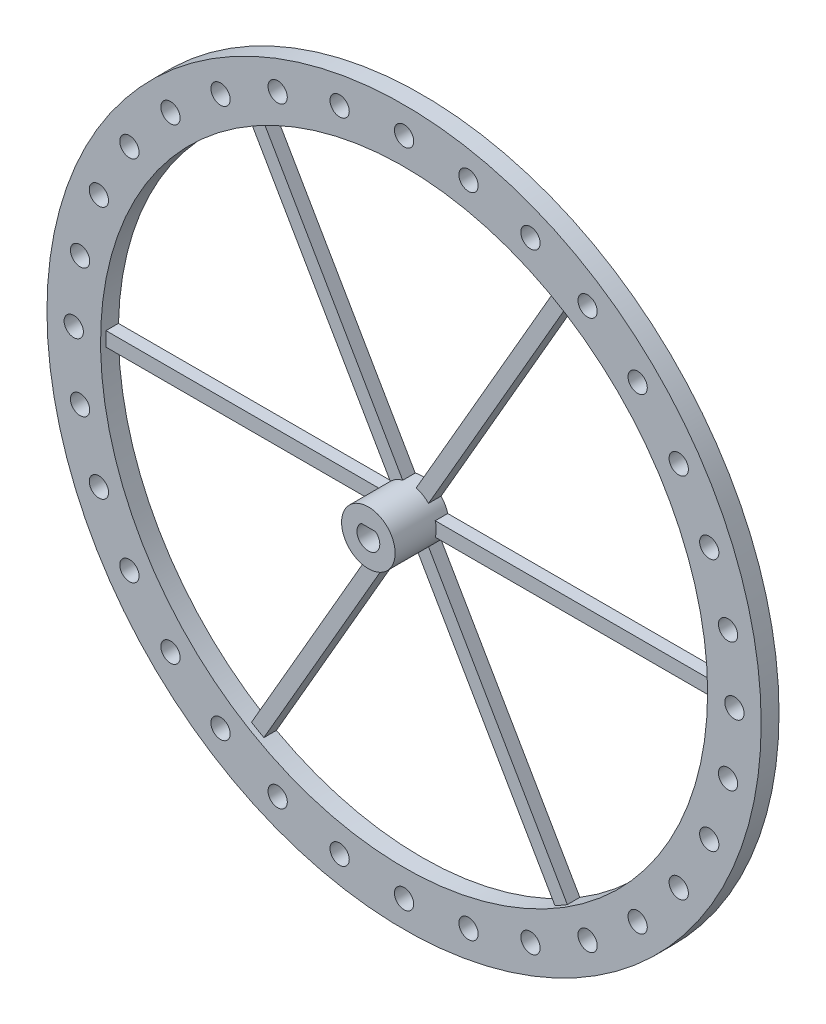
from build123d import *

# Parameters (mm, degrees)
SKETCH1_R           = 2.7
BOSS_EXTRUDE1_DEPTH = 5
SKETCH2_R           = 7.5
BOSS_EXTRUDE2_DEPTH = 15
BOSS_EXTRUDE3_DEPTH = 3.5


with BuildPart() as part:
    # Sketch1 → Boss-Extrude1 (new body)
    # profile 1 of 4: a face of its own
    with BuildSketch(Plane.XY):
        with BuildLine():
            Line((0, 89.8), (0, 85))
            ThreePointArc((0, 85), (60.104076401, 60.104076401), (85, 0))
            Line((85, 0), (89.8, 0))
            ThreePointArc((89.8, 0), (92.5, 2.7), (95.2, 0))
            Line((95.2, 0), (100, 0))
            ThreePointArc((100, 0), (70.710678119, 70.710678119), (0, 100))
            Line((0, 100), (0, 95.2))
            ThreePointArc((0, 95.2), (1.909188309, 94.409188309), (2.7, 92.5))
            ThreePointArc((2.7, 92.5), (1.909188309, 90.590811691), (0, 89.8))
        make_face()
        with Locations((90.722638437, 18.045854786)):
            Circle(SKETCH1_R, mode=Mode.SUBTRACT)
        with Locations((85.458856757, 35.398217494)):
            Circle(SKETCH1_R, mode=Mode.SUBTRACT)
        with Locations((18.045854786, 90.722638437)):
            Circle(SKETCH1_R, mode=Mode.SUBTRACT)
        with Locations((35.398217494, 85.458856757)):
            Circle(SKETCH1_R, mode=Mode.SUBTRACT)
        with Locations((65.40737726, 65.40737726)):
            Circle(SKETCH1_R, mode=Mode.SUBTRACT)
        with Locations((76.910939138, 51.390246554)):
            Circle(SKETCH1_R, mode=Mode.SUBTRACT)
        with Locations((51.390246554, 76.910939138)):
            Circle(SKETCH1_R, mode=Mode.SUBTRACT)
    # profile 2 of 4: a face of its own
    with BuildSketch(Plane.XY):
        with BuildLine():
            ThreePointArc((85, 0), (60.104076401, -60.104076401), (0, -85))
            Line((0, -85), (0, -89.8))
            ThreePointArc((0, -89.8), (1.909188309, -90.590811691), (2.7, -92.5))
            ThreePointArc((2.7, -92.5), (1.909188309, -94.409188309), (0, -95.2))
            Line((0, -95.2), (0, -100))
            ThreePointArc((0, -100), (70.710678119, -70.710678119), (100, 0))
            Line((100, 0), (95.2, 0))
            ThreePointArc((95.2, 0), (92.5, -2.7), (89.8, 0))
            Line((89.8, 0), (85, 0))
        make_face()
        with Locations((18.045854786, -90.722638437)):
            Circle(SKETCH1_R, mode=Mode.SUBTRACT)
        with Locations((35.398217494, -85.458856757)):
            Circle(SKETCH1_R, mode=Mode.SUBTRACT)
        with Locations((51.390246554, -76.910939138)):
            Circle(SKETCH1_R, mode=Mode.SUBTRACT)
        with Locations((65.40737726, -65.40737726)):
            Circle(SKETCH1_R, mode=Mode.SUBTRACT)
        with Locations((76.910939138, -51.390246554)):
            Circle(SKETCH1_R, mode=Mode.SUBTRACT)
        with Locations((85.458856757, -35.398217494)):
            Circle(SKETCH1_R, mode=Mode.SUBTRACT)
        with Locations((90.722638437, -18.045854786)):
            Circle(SKETCH1_R, mode=Mode.SUBTRACT)
    # profile 3 of 4: a face of its own
    with BuildSketch(Plane.XY):
        with BuildLine():
            ThreePointArc((0, -85), (-60.104076401, -60.104076401), (-85, 0))
            Line((-85, 0), (-89.8, 0))
            ThreePointArc((-89.8, 0), (-92.5, -2.7), (-95.2, 0))
            Line((-95.2, 0), (-100, 0))
            ThreePointArc((-100, 0), (-70.710678119, -70.710678119), (0, -100))
            Line((0, -100), (0, -95.2))
            ThreePointArc((0, -95.2), (-2.7, -92.5), (0, -89.8))
            Line((0, -89.8), (0, -85))
        make_face()
        with Locations((-51.390246554, -76.910939138)):
            Circle(SKETCH1_R, mode=Mode.SUBTRACT)
        with Locations((-76.910939138, -51.390246554)):
            Circle(SKETCH1_R, mode=Mode.SUBTRACT)
        with Locations((-65.40737726, -65.40737726)):
            Circle(SKETCH1_R, mode=Mode.SUBTRACT)
        with Locations((-35.398217494, -85.458856757)):
            Circle(SKETCH1_R, mode=Mode.SUBTRACT)
        with Locations((-18.045854786, -90.722638437)):
            Circle(SKETCH1_R, mode=Mode.SUBTRACT)
        with Locations((-85.458856757, -35.398217494)):
            Circle(SKETCH1_R, mode=Mode.SUBTRACT)
        with Locations((-90.722638437, -18.045854786)):
            Circle(SKETCH1_R, mode=Mode.SUBTRACT)
    # profile 4 of 4: a face of its own
    with BuildSketch(Plane.XY):
        with BuildLine():
            Line((-89.8, 0), (-85, 0))
            ThreePointArc((-85, 0), (-60.104076401, 60.104076401), (0, 85))
            Line((0, 85), (0, 89.8))
            ThreePointArc((0, 89.8), (-2.7, 92.5), (0, 95.2))
            Line((0, 95.2), (0, 100))
            ThreePointArc((0, 100), (-70.710678119, 70.710678119), (-100, 0))
            Line((-100, 0), (-95.2, 0))
            ThreePointArc((-95.2, 0), (-92.5, 2.7), (-89.8, 0))
        make_face()
        with Locations((-90.722638437, 18.045854786)):
            Circle(SKETCH1_R, mode=Mode.SUBTRACT)
        with Locations((-85.458856757, 35.398217494)):
            Circle(SKETCH1_R, mode=Mode.SUBTRACT)
        with Locations((-76.910939138, 51.390246554)):
            Circle(SKETCH1_R, mode=Mode.SUBTRACT)
        with Locations((-65.40737726, 65.40737726)):
            Circle(SKETCH1_R, mode=Mode.SUBTRACT)
        with Locations((-51.390246554, 76.910939138)):
            Circle(SKETCH1_R, mode=Mode.SUBTRACT)
        with Locations((-35.398217494, 85.458856757)):
            Circle(SKETCH1_R, mode=Mode.SUBTRACT)
        with Locations((-18.045854786, 90.722638437)):
            Circle(SKETCH1_R, mode=Mode.SUBTRACT)
    extrude(amount=BOSS_EXTRUDE1_DEPTH)



with BuildPart() as body_2:
    # Sketch2 → Boss-Extrude2 (new body)
    with BuildSketch(Plane.XY):
        Circle(SKETCH2_R)
        with BuildLine():
            Line((-1.997498436, 2.5), (1.997498436, 2.5))
            ThreePointArc((1.997498436, 2.5), (0, -3.2), (-1.997498436, 2.5))
        make_face(mode=Mode.SUBTRACT)
    extrude(amount=BOSS_EXTRUDE2_DEPTH)


with BuildPart() as part_1:
    add(part.part)

    add(body_2.part)  # Boss-Extrude3 merges body 2
    # Sketch3 → Boss-Extrude3 (add)
    with BuildSketch(Plane.XY):
        with BuildLine():
            Line((84.976467331, 2), (7.228416147, 2))
            ThreePointArc((7.228416147, 2), (7.5, 0), (7.228416147, -2))
            Line((7.228416147, -2), (84.976467331, -2))
            ThreePointArc((84.976467331, -2), (85, 0), (84.976467331, 2))
        make_face()
        with BuildLine():
            Line((44.220284473, -72.591779432), (5.346258881, -5.259992013))
            ThreePointArc((5.346258881, -5.259992013), (3.75, -6.495190528), (1.882157266, -7.259992013))
            Line((1.882157266, -7.259992013), (40.756182858, -74.591779432))
            ThreePointArc((40.756182858, -74.591779432), (42.5, -73.612159322), (44.220284473, -72.591779432))
        make_face()
        with BuildLine():
            Line((-40.756182858, -74.591779432), (-1.882157266, -7.259992013))
            ThreePointArc((-1.882157266, -7.259992013), (-3.75, -6.495190528), (-5.346258881, -5.259992013))
            Line((-5.346258881, -5.259992013), (-44.220284473, -72.591779432))
            ThreePointArc((-44.220284473, -72.591779432), (-42.5, -73.612159322), (-40.756182858, -74.591779432))
        make_face()
        with BuildLine():
            Line((-84.976467331, -2), (-7.228416147, -2))
            ThreePointArc((-7.228416147, -2), (-7.5, 0), (-7.228416147, 2))
            Line((-7.228416147, 2), (-84.976467331, 2))
            ThreePointArc((-84.976467331, 2), (-85, 0), (-84.976467331, -2))
        make_face()
        with BuildLine():
            Line((-44.220284473, 72.591779432), (-5.346258881, 5.259992013))
            ThreePointArc((-5.346258881, 5.259992013), (-3.75, 6.495190528), (-1.882157266, 7.259992013))
            Line((-1.882157266, 7.259992013), (-40.756182858, 74.591779432))
            ThreePointArc((-40.756182858, 74.591779432), (-42.5, 73.612159322), (-44.220284473, 72.591779432))
        make_face()
        with BuildLine():
            Line((40.756182858, 74.591779432), (1.882157266, 7.259992013))
            ThreePointArc((1.882157266, 7.259992013), (3.75, 6.495190528), (5.346258881, 5.259992013))
            Line((5.346258881, 5.259992013), (44.220284473, 72.591779432))
            ThreePointArc((44.220284473, 72.591779432), (42.5, 73.612159322), (40.756182858, 74.591779432))
        make_face()
    extrude(amount=BOSS_EXTRUDE3_DEPTH)


solid = part_1.part
